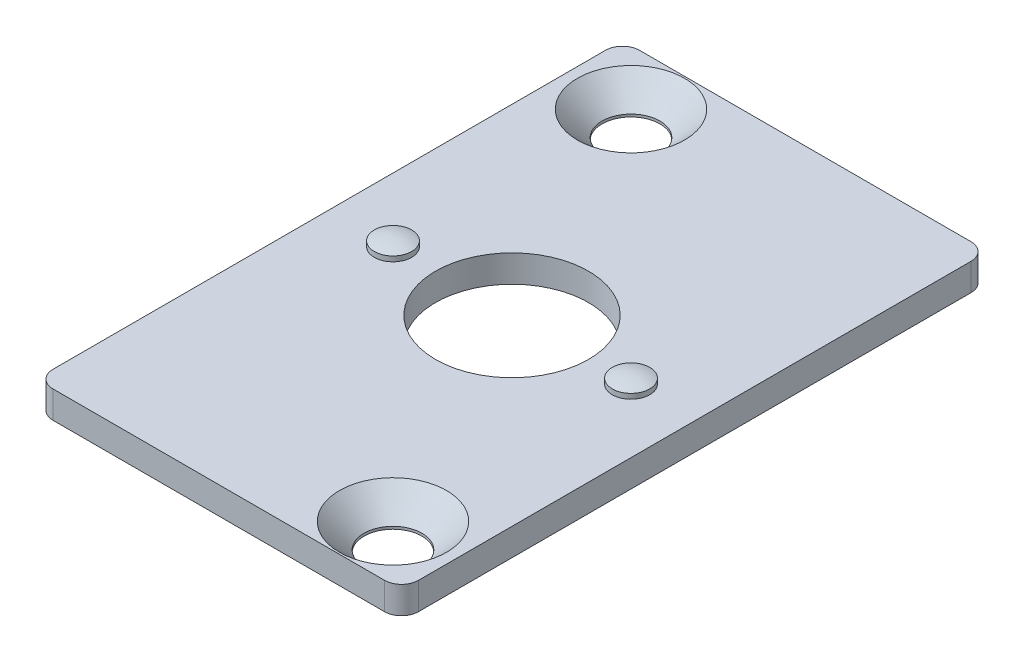
from build123d import *

# Parameters (mm, degrees)
BASES_W                                         = 21.5
BASES_H                                         = 34.5
BASE_DEPTH                                      = 1.6
CSK_FOR_M3_FLAT_HEAD_MACHINE_SCREW1_D           = 3.4
CSK_FOR_M3_FLAT_HEAD_MACHINE_SCREW1_DEPTH       = 11
CSK_FOR_M3_FLAT_HEAD_MACHINE_SCREW1_CSINK_D     = 6.3
CSK_FOR_M3_FLAT_HEAD_MACHINE_SCREW1_CSINK_ANGLE = 90
CSK_FOR_M3_FLAT_HEAD_MACHINE_SCREW1_TIP         = 1.021463052
BORES_R                                         = 4.5
BORE_DEPTH                                      = 21.388354519
LOCKINGFEATURES_R                               = 1.1
LOCKING_FEATURE_DEPTH                           = 0.3
LF_DOME_FACE_RADIUS                             = 1.1
LF_DOME_HEIGHT                                  = 0.2
LF_HM_COPY_1_FACE_RADIUS                        = 1.1
LF_HM_COPY_1_HEIGHT                             = 0.2
LFBOTTOMCUT_R                                   = 1.1
LF_BOTTOM_CUT_DEPTH                             = 0.3
BASE_FILLET_R                                   = 1


with BuildPart() as part:
    # BaseS → BASE (new body)
    with BuildSketch(Plane(origin=(0, 0, 0), x_dir=(1, 0, 0), z_dir=(0, 1, 0))):
        Rectangle(BASES_W, BASES_H)
    extrude(amount=-BASE_DEPTH)

    # CSK for M3 Flat Head Machine Screw1
    with Locations(Plane(origin=(0, 0, 0), x_dir=(1, 0, 0), z_dir=(0, 1, 0))):
        with Locations((-7, 14), (7, -14)):
            CounterSinkHole(CSK_FOR_M3_FLAT_HEAD_MACHINE_SCREW1_D / 2, CSK_FOR_M3_FLAT_HEAD_MACHINE_SCREW1_CSINK_D / 2, depth=CSK_FOR_M3_FLAT_HEAD_MACHINE_SCREW1_DEPTH, counter_sink_angle=CSK_FOR_M3_FLAT_HEAD_MACHINE_SCREW1_CSINK_ANGLE)
            with Locations((0, 0, -(CSK_FOR_M3_FLAT_HEAD_MACHINE_SCREW1_DEPTH + CSK_FOR_M3_FLAT_HEAD_MACHINE_SCREW1_TIP / 2))):  # 118° drill point
                Cone(0, CSK_FOR_M3_FLAT_HEAD_MACHINE_SCREW1_D / 2, CSK_FOR_M3_FLAT_HEAD_MACHINE_SCREW1_TIP, mode=Mode.SUBTRACT)

    # BoreS → BORE (cut, through all)
    with BuildSketch(Plane(origin=(0, 0, 0), x_dir=(1, 0, 0), z_dir=(0, 1, 0))):
        with Locations(Location((0, 0, 0), (0, 0, 270))):
            Circle(BORES_R)
    extrude(amount=-BORE_DEPTH, mode=Mode.SUBTRACT)

    # LockingFeatureS → LOCKING FEATURE (add)
    with BuildSketch(Plane(origin=(0, 0, 0), x_dir=(1, 0, 0), z_dir=(0, 1, 0))):
        with Locations(Location((-7, 0, 0), (0, 0, 270))):
            Circle(LOCKINGFEATURES_R)
    locking_feature = extrude(amount=LOCKING_FEATURE_DEPTH)

    # LF DOME: a dome of height H over a round flat face of radius A is a cap of a sphere of radius (A * A + H * H) / (2 * H)
    lf_dome_r = (LF_DOME_FACE_RADIUS * LF_DOME_FACE_RADIUS + LF_DOME_HEIGHT * LF_DOME_HEIGHT) / (2 * LF_DOME_HEIGHT)
    lf_dome_base = Plane((-7, 0.3, 0), z_dir=(0, 1, 0))
    with Locations(lf_dome_base.offset(LF_DOME_HEIGHT - lf_dome_r)):
        lf_dome_ball = Sphere(lf_dome_r, mode=Mode.PRIVATE)
    add(split(lf_dome_ball, bisect_by=lf_dome_base, keep=Keep.TOP, mode=Mode.PRIVATE))

    # LF HM: LOCKING FEATURE across plane
    add(locking_feature.mirror(Plane(origin=(0, 0, 0), x_dir=(0, 0, 1), z_dir=(1, 0, 0))))

    # LF HM copy 1: a dome of height H over a round flat face of radius A is a cap of a sphere of radius (A * A + H * H) / (2 * H)
    lf_hm_copy_1_r = (LF_HM_COPY_1_FACE_RADIUS * LF_HM_COPY_1_FACE_RADIUS + LF_HM_COPY_1_HEIGHT * LF_HM_COPY_1_HEIGHT) / (2 * LF_HM_COPY_1_HEIGHT)
    lf_hm_copy_1_base = Plane((7, 0.3, 0), z_dir=(0, 1, 0))
    with Locations(lf_hm_copy_1_base.offset(LF_HM_COPY_1_HEIGHT - lf_hm_copy_1_r)):
        lf_hm_copy_1_ball = Sphere(lf_hm_copy_1_r, mode=Mode.PRIVATE)
    add(split(lf_hm_copy_1_ball, bisect_by=lf_hm_copy_1_base, keep=Keep.TOP, mode=Mode.PRIVATE))

    # LFBottomCut → LF BOTTOM CUT (cut)
    with BuildSketch(Plane(origin=(0, -1.6, 0), x_dir=(-1, 0, 0), z_dir=(0, -1, 0))):
        with Locations(Location((7, 0, 0), (0, 0, 270))):
            Circle(LFBOTTOMCUT_R)
        with Locations(Location((-7, 0, 0), (0, 0, 270))):
            Circle(LFBOTTOMCUT_R)
    extrude(amount=-LF_BOTTOM_CUT_DEPTH, mode=Mode.SUBTRACT)

    # BASE FILLET
    base_fillet_edges = [part.edges().sort_by_distance(p)[0] for p in [
        (10.75, -0.8, 17.25),
        (-10.75, -0.8, 17.25),
        (-10.75, -0.8, -17.25),
        (10.75, -0.8, -17.25),
    ]]
    fillet(base_fillet_edges, radius=BASE_FILLET_R)


solid = part.part
